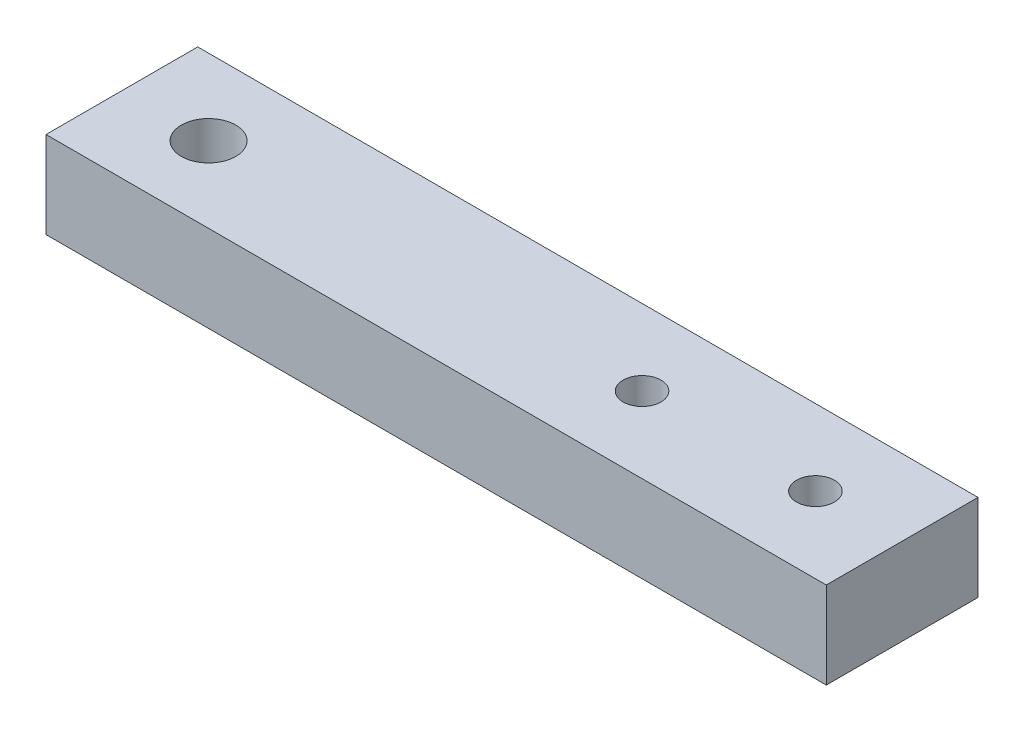
from build123d import *

# Parameters (mm, degrees)
SKETCH1_W           = 304.8
SKETCH1_H           = 304.8
BOSS_EXTRUDE1_DEPTH = 6.35
CUT_EXTRUDE2_DEPTH  = 6.35
SKETCH3_R           = 1.9939
SKETCH3_R_2         = 1.3890625
CUT_EXTRUDE3_DEPTH  = 311.176538442


with BuildPart() as part:
    # Sketch1 → Boss-Extrude1 (new body)
    with BuildSketch(Plane(origin=(0, 0, 0), x_dir=(1, 0, 0), z_dir=(0, 1, 0))):
        with Locations((152.4, 152.4)):
            Rectangle(SKETCH1_W, SKETCH1_H)
    extrude(amount=BOSS_EXTRUDE1_DEPTH)

    # Sketch2 → Cut-Extrude2 (cut)
    with BuildSketch(Plane(origin=(0, 6.35, 0), x_dir=(1, 0, 0), z_dir=(0, 1, 0))):
        Polygon((57.15, 304.8), (57.15, 293.6875), (0, 293.6875), (0, 0), (304.8, 0), (304.8, 304.8), align=None)
    extrude(amount=-CUT_EXTRUDE2_DEPTH, mode=Mode.SUBTRACT)

    # Sketch3 → Cut-Extrude3 (cut, through all)
    with BuildSketch(Plane(origin=(0, 6.35, 0), x_dir=(1, 0, 0), z_dir=(0, 1, 0))):
        with Locations(Location((6.35, 299.24375, 0), (0, 0, 270))):
            Circle(SKETCH3_R)
        with Locations(Location((50.8, 299.24375, 0), (0, 0, 270))):
            Circle(SKETCH3_R_2)
        with Locations(Location((38.1, 299.24375, 0), (0, 0, 270))):
            Circle(SKETCH3_R_2)
    extrude(amount=-CUT_EXTRUDE3_DEPTH, mode=Mode.SUBTRACT)


solid = part.part
